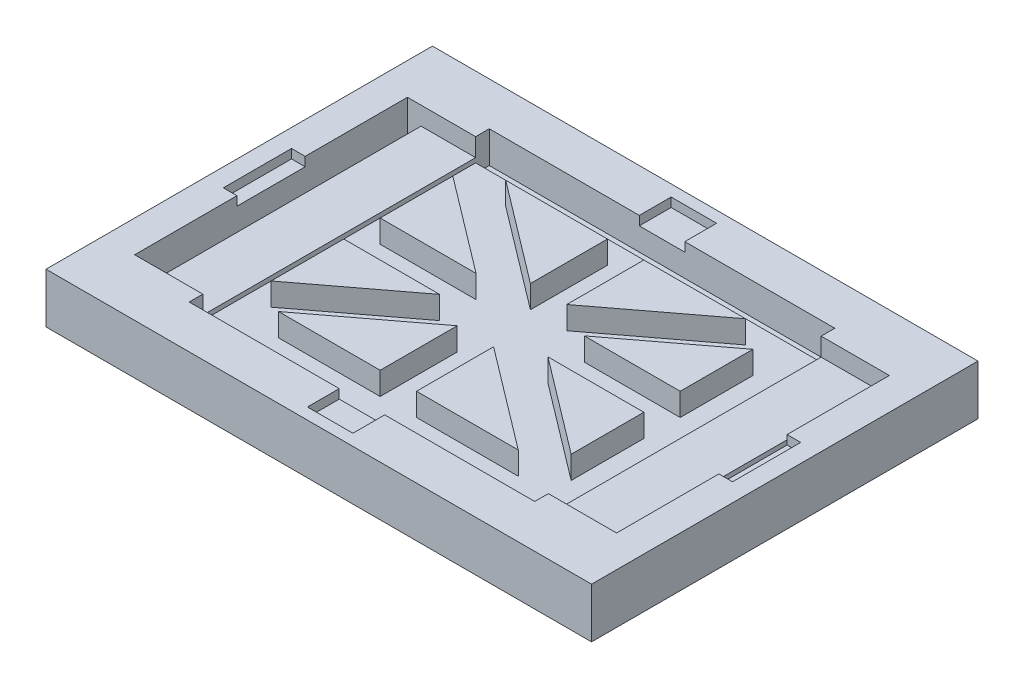
from build123d import *

# Parameters (mm, degrees)
SKETCH1_W            = 120
SKETCH1_H            = 85
BOSS_EXTRUDE1_DEPTH  = 15
SKETCH9_W            = 12
SKETCH9_H            = 60
BOSS_EXTRUDE2_DEPTH  = 11
SKETCH10_W           = 76
SKETCH10_H           = 60
BOSS_EXTRUDE4_DEPTH  = 10
SKETCH12_W           = 3
SKETCH12_H           = 60
BOSS_EXTRUDE11_DEPTH = 6
BOSS_EXTRUDE12_DEPTH = 5
SKETCH14_W           = 76
SKETCH14_H           = 3
BOSS_EXTRUDE13_DEPTH = 8
SKETCH15_W           = 3
SKETCH15_H           = 15
SKETCH15_W_2         = 10
SKETCH15_H_2         = 7
BOSS_EXTRUDE14_DEPTH = 13
SKETCH16_W           = 120
SKETCH16_H           = 85
CUT_EXTRUDE3_DEPTH   = 4


with BuildPart() as part:
    # Sketch1 → Boss-Extrude1 (new body)
    with BuildSketch(Plane(origin=(0, 0, 0), x_dir=(1, 0, 0), z_dir=(0, 1, 0))):
        Rectangle(SKETCH1_W, SKETCH1_H)
        Polygon((-50, -30), (-53, -30), (-53, -7.5), (-56, -7.5), (-56, 7.5), (-53, 7.5), (-53, 25), (-53, 30), (-50, 30), (-38, 30), (-38, 33), (-5, 33), (-5, 40), (5, 40), (5, 33), (38, 33), (38, 30), (50, 30), (53, 30), (53, 7.5), (56, 7.5), (56, -7.5), (53, -7.5), (53, -30), (50, -30), (38, -30), (38, -33), (5, -33), (5, -40), (-5, -40), (-5, -33), (-38, -33), (-38, -30), align=None, mode=Mode.SUBTRACT)
    extrude(amount=BOSS_EXTRUDE1_DEPTH)

    # Sketch9 → Boss-Extrude2 (add)
    with BuildSketch(Plane(origin=(0, 0, 0), x_dir=(1, 0, 0), z_dir=(0, 1, 0))):
        with Locations((-44, 0)):
            Rectangle(SKETCH9_W, SKETCH9_H)
        with Locations((44, 0)):
            Rectangle(SKETCH9_W, SKETCH9_H)
    extrude(amount=BOSS_EXTRUDE2_DEPTH)

    # Sketch10 → Boss-Extrude4 (add)
    with BuildSketch(Plane(origin=(0, 0, 0), x_dir=(1, 0, 0), z_dir=(0, 1, 0))):
        Rectangle(SKETCH10_W, SKETCH10_H)
    extrude(amount=BOSS_EXTRUDE4_DEPTH)

    # Sketch12 → Boss-Extrude11 (add)
    with BuildSketch(Plane(origin=(0, 0, 0), x_dir=(1, 0, 0), z_dir=(0, 1, 0))):
        with Locations((-51.5, 0)):
            Rectangle(SKETCH12_W, SKETCH12_H)
        with Locations((51.5, 0)):
            Rectangle(SKETCH12_W, SKETCH12_H)
    extrude(amount=BOSS_EXTRUDE11_DEPTH)

    # Sketch13 → Boss-Extrude12 (add)
    with BuildSketch(Plane(origin=(0, 10, 0), x_dir=(1, 0, 0), z_dir=(0, 1, 0))):
        Polygon((-33, 19.981759626), (-33, 4), (-11.904077294, 4), align=None)
        Polygon((-26.375922706, 25), (-4, 8.048543405), (-4, 25), align=None)
        Polygon((4, 25), (4, 8.048543405), (26.375922706, 25), align=None)
        Polygon((11.904077294, 4), (33, 4), (33, 19.981759626), align=None)
        Polygon((11.904077294, -4), (33, -19.981759626), (33, -4), align=None)
        Polygon((4, -8.048543405), (4, -25), (26.375922706, -25), align=None)
        Polygon((-26.375922706, -25), (-4, -25), (-4, -8.048543405), align=None)
        Polygon((-33, -4), (-33, -19.981759626), (-11.904077294, -4), align=None)
    extrude(amount=BOSS_EXTRUDE12_DEPTH)

    # Sketch14 → Boss-Extrude13 (add)
    with BuildSketch(Plane(origin=(0, 0, 0), x_dir=(1, 0, 0), z_dir=(0, 1, 0))):
        with Locations((0, 31.5)):
            Rectangle(SKETCH14_W, SKETCH14_H)
        with Locations((0, -31.5)):
            Rectangle(SKETCH14_W, SKETCH14_H)
    extrude(amount=BOSS_EXTRUDE13_DEPTH)

    # Sketch15 → Boss-Extrude14 (add)
    with BuildSketch(Plane(origin=(0, 0, 0), x_dir=(1, 0, 0), z_dir=(0, 1, 0))):
        with Locations((-54.5, 0)):
            Rectangle(SKETCH15_W, SKETCH15_H)
        with Locations((0, -36.5)):
            Rectangle(SKETCH15_W_2, SKETCH15_H_2)
        with Locations((54.5, 0)):
            Rectangle(SKETCH15_W, SKETCH15_H)
        with Locations((0, 36.5)):
            Rectangle(SKETCH15_W_2, SKETCH15_H_2)
    extrude(amount=BOSS_EXTRUDE14_DEPTH)

    # Sketch16 → Cut-Extrude3 (cut)
    with BuildSketch(Plane.XZ):
        Rectangle(SKETCH16_W, SKETCH16_H)
    extrude(amount=-CUT_EXTRUDE3_DEPTH, mode=Mode.SUBTRACT)


solid = part.part
